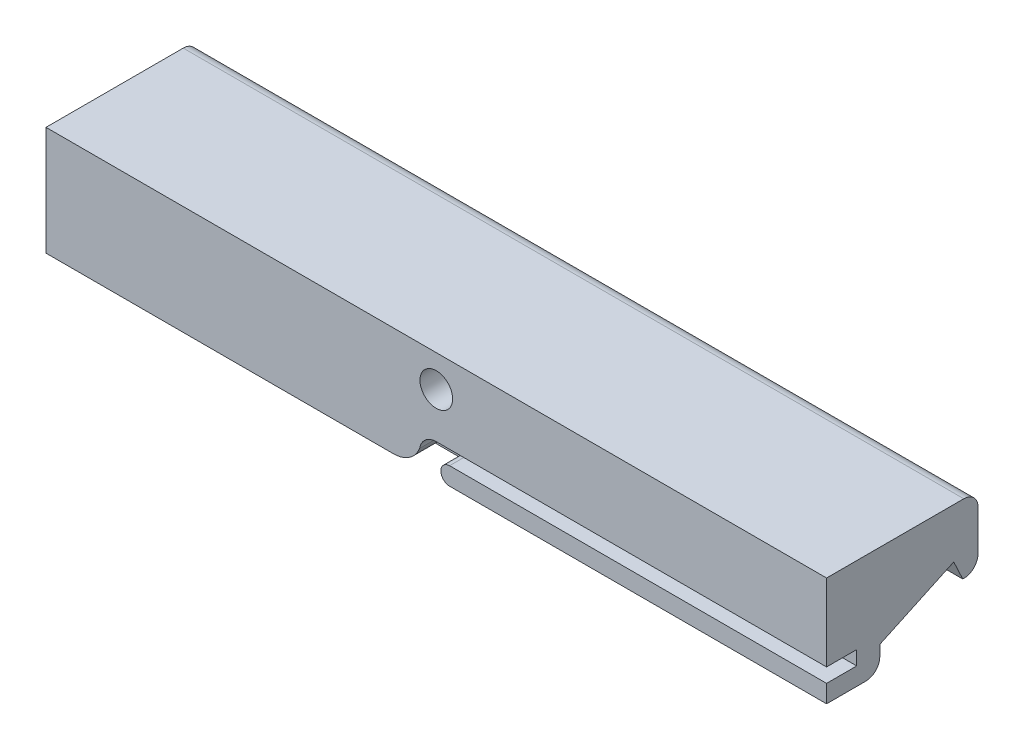
from build123d import *

# Parameters (mm, degrees)
PROFILEBOSS_EXTRUDE1_DEPTH      = 110
SKETCH3_R                       = 2.3
MOUNTINGHOLESCUT_EXTRUDE3_DEPTH = 4.5
XAXISCABLECUT_EXTRUDE1_DEPTH    = 4.25


with BuildPart() as part:
    # Sketch1 → ProfileBoss-Extrude1 (new body)
    with BuildSketch(Plane(origin=(0, 0, 0), x_dir=(0, 0, -1), z_dir=(1, 0, 0))):
        with BuildLine():
            Line((0, 0), (5.499461553, 0))
            ThreePointArc((5.499461553, 0), (6.914055855, 0.585944145), (7.5, 2.000538447))
            Line((7.5, 2.000538447), (7.5, 3.5))
            Line((7.5, 3.5), (17.922539551, 8.36011001))
            Line((17.922539551, 8.36011001), (19.190394336, 5.641186649))
            ThreePointArc((19.190394336, 5.641186649), (20.700753359, 6.16912635), (21.340729536, 7.635528477))
            Line((21.340729536, 7.635528477), (21.340729536, 13.36011001))
            ThreePointArc((21.340729536, 13.36011001), (20.754943098, 14.774323572), (19.340729536, 15.36011001))
            Line((19.340729536, 15.36011001), (0, 15.36011001))
            Line((0, 15.36011001), (0, 0))
        make_face()
    extrude(amount=PROFILEBOSS_EXTRUDE1_DEPTH)

    # Sketch3 → MountingHolesCut-Extrude3 (cut)
    with BuildSketch(Plane.XY):
        with Locations((55, 10.86011001)):
            Circle(SKETCH3_R)
    extrude(amount=-MOUNTINGHOLESCUT_EXTRUDE3_DEPTH, mode=Mode.SUBTRACT)

    # Sketch4 → XAxisCableCut-Extrude1 (cut)
    with BuildSketch(Plane.XY):
        with BuildLine():
            Line((55, 4.5), (110, 4.5))
            Line((110, 4.5), (110, 2.5))
            Line((110, 2.5), (56.872897785, 2.5))
            ThreePointArc((56.872897785, 2.5), (55.642642805, 1.25), (56.872897785, 0))
            Line((56.872897785, 0), (48.989527283, 0))
            ThreePointArc((48.989527283, 0), (51.20727122, 0.684547643), (52.653343966, 2.5))
            ThreePointArc((52.653343966, 2.5), (53.458345487, 3.932167796), (55, 4.5))
        make_face()
    extrude(amount=-XAXISCABLECUT_EXTRUDE1_DEPTH, mode=Mode.SUBTRACT)


solid = part.part
